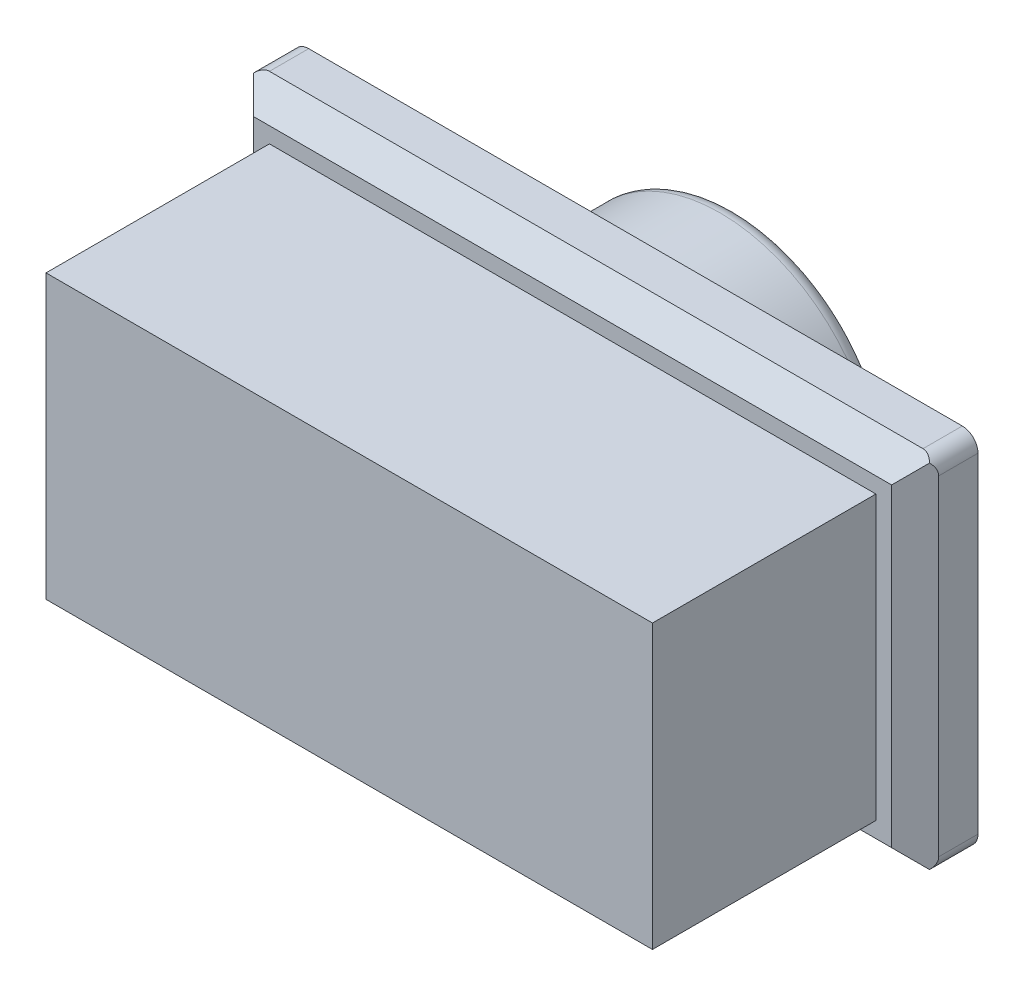
from build123d import *

# Parameters (mm, degrees)
SKETCH1_W         = 9.652
SKETCH1_H         = 4.5
BUTTON_BASE_DEPTH = 3.556
SKETCH2_W         = 10.9020356
SKETCH2_H         = 5.7500356
GUIDE_DEPTH       = 1
SKETCH3_R         = 2.54
ARM_DEPTH         = 1.6002
CHAMFER1_SIZE     = 0.375
FILLET1_R         = 0.25
FILLET2_R         = 0.254


with BuildPart() as part:
    # Sketch1 → Button Base (new body)
    with BuildSketch(Plane.XY):
        Rectangle(SKETCH1_W, SKETCH1_H)
    extrude(amount=BUTTON_BASE_DEPTH)

    # Sketch2 → Guide (add)
    with BuildSketch(Plane(origin=(0, 0, 0), x_dir=(-1, 0, 0), z_dir=(0, 0, -1))):
        Rectangle(SKETCH2_W, SKETCH2_H)
    extrude(amount=GUIDE_DEPTH)

    # Sketch3 → Arm (add)
    with BuildSketch(Plane(origin=(0, 0, -1), x_dir=(-1, 0, 0), z_dir=(0, 0, -1))):
        Circle(SKETCH3_R)
    extrude(amount=ARM_DEPTH)

    # Chamfer1
    chamfer1_edges = [part.edges().sort_by_distance(p)[0] for p in [
        (0, -2.8750178, 0),
        (-5.4510178, 0, 0),
        (0, 2.8750178, 0),
        (5.4510178, 0, 0),
    ]]
    chamfer(chamfer1_edges, length=CHAMFER1_SIZE)

    # Fillet1
    fillet1_edges = [part.edges().sort_by_distance(p)[0] for p in [
        (5.4510178, -2.8750178, -0.6875),
        (-5.4510178, -2.8750178, -0.6875),
        (-5.4510178, 2.8750178, -0.6875),
        (5.4510178, 2.8750178, -0.6875),
    ]]
    fillet(fillet1_edges, radius=FILLET1_R)

    # Fillet2
    fillet2_edges = [part.edges().sort_by_distance(p)[0] for p in [
        (2.54, 0, -2.6002),
    ]]
    fillet(fillet2_edges, radius=FILLET2_R)


solid = part.part
